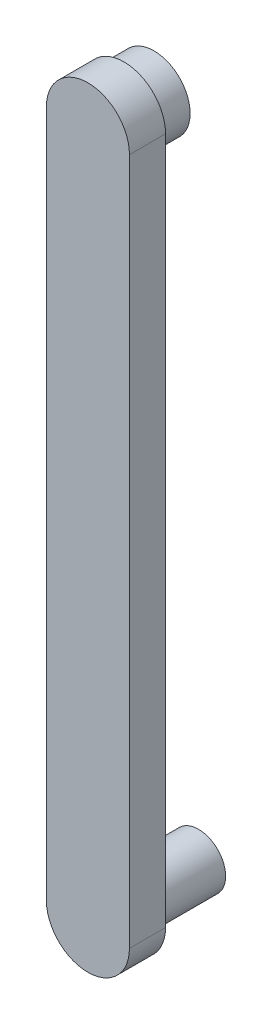
from build123d import *

# Parameters (mm, degrees)
BOSS_EXTRUDE1_DEPTH = 100
SKETCH1_4_R         = 100
BOSS_EXTRUDE3_DEPTH = 83.10006502
SKETCH1_5_R         = 75
BOSS_EXTRUDE4_DEPTH = 206.380604418


with BuildPart() as part:
    # Sketch1 → Boss-Extrude1 (new body)
    with BuildSketch(Plane.XY):
        with BuildLine():
            Line((-115, 0), (-115, 1903.73))
            ThreePointArc((-115, 1903.73), (0, 2018.73), (115, 1903.73))
            Line((115, 1903.73), (115, 0))
            ThreePointArc((115, 0), (0, -115), (-115, 0))
        make_face()
    extrude(amount=BOSS_EXTRUDE1_DEPTH)

    # Sketch1<4> → Boss-Extrude3 (add)
    with BuildSketch(Plane.XY):
        with Locations((0, 1903.73)):
            Circle(SKETCH1_4_R)
    extrude(amount=-BOSS_EXTRUDE3_DEPTH)

    # Sketch1<5> → Boss-Extrude4 (add)
    with BuildSketch(Plane.XY):
        Circle(SKETCH1_5_R)
    extrude(amount=-BOSS_EXTRUDE4_DEPTH)


solid = part.part
